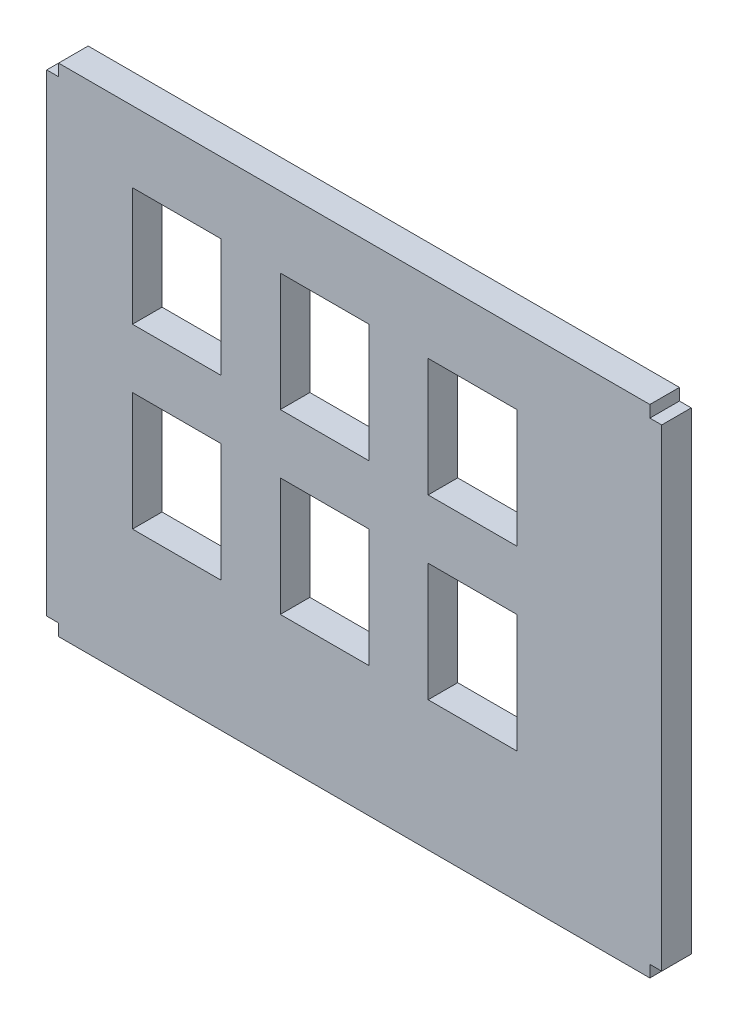
from build123d import *

# Parameters (mm, degrees)
SKETCH1_W           = 15
SKETCH1_H           = 20
BOSS_EXTRUDE1_DEPTH = 5


with BuildPart() as part:
    # Sketch1 → Boss-Extrude1 (new body)
    with BuildSketch(Plane.XY):
        Polygon((-54, -43), (-54, 37), (-52, 37), (-52, 39), (48, 39), (48, 37), (50, 37), (50, -43), (48, -43), (48, -45), (-52, -45), (-52, -43), align=None)
        with Locations((-7, 17)):
            Rectangle(SKETCH1_W, SKETCH1_H, mode=Mode.SUBTRACT)
        with Locations((-32, 17)):
            Rectangle(SKETCH1_W, SKETCH1_H, mode=Mode.SUBTRACT)
        with Locations((18, 17)):
            Rectangle(SKETCH1_W, SKETCH1_H, mode=Mode.SUBTRACT)
        with Locations((-7, -13)):
            Rectangle(SKETCH1_W, SKETCH1_H, mode=Mode.SUBTRACT)
        with Locations((18, -13)):
            Rectangle(SKETCH1_W, SKETCH1_H, mode=Mode.SUBTRACT)
        with Locations((-32, -13)):
            Rectangle(SKETCH1_W, SKETCH1_H, mode=Mode.SUBTRACT)
    extrude(amount=BOSS_EXTRUDE1_DEPTH)


solid = part.part
